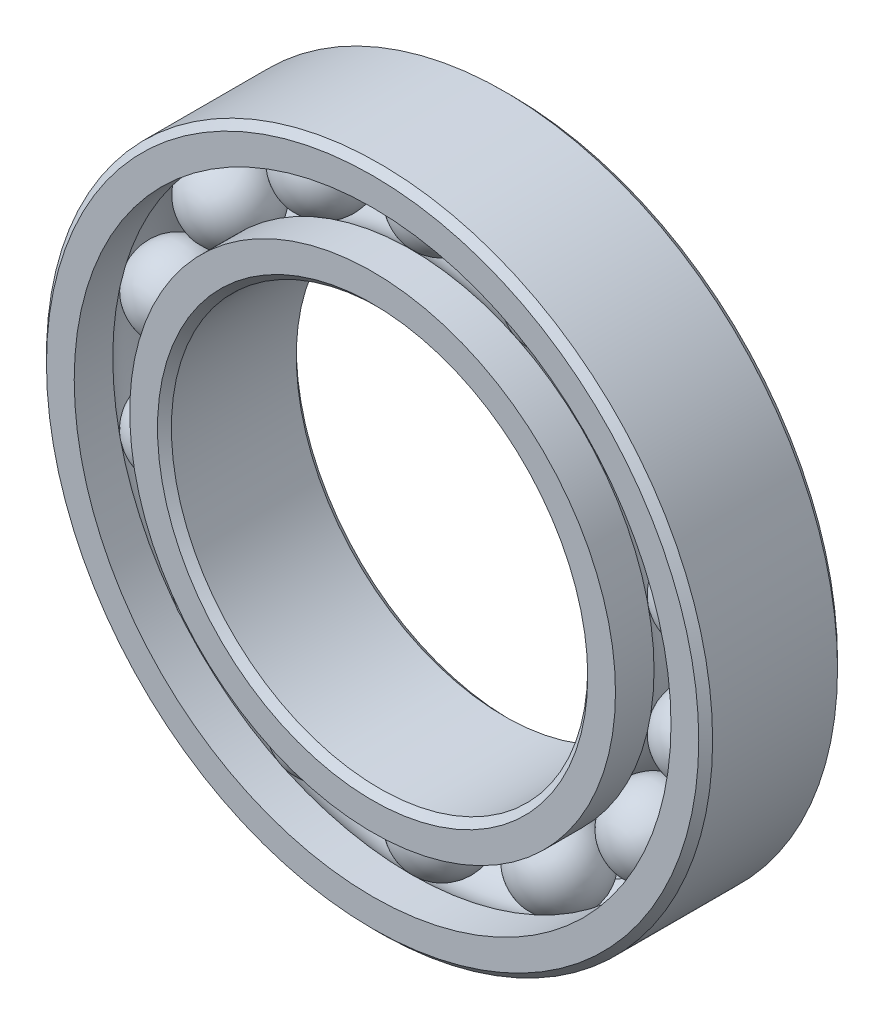
from build123d import *

# Parameters (mm, degrees)
CIRPATTERN1_COUNT = 14


with BuildPart() as part:
    # Sketch5 → Revolve1 (revolve)
    with BuildSketch(Plane(origin=(0, 0, 0), x_dir=(0, 0, -1), z_dir=(1, 0, 0))):
        with BuildLine():
            Line((2.25, 12), (-2.25, 12))
            Line((-2.25, 12), (-2.5, 11.75))
            Line((-2.5, 11.75), (-2.5, 10.75))
            Line((-2.5, 10.75), (-1.111111111, 10.75))
            ThreePointArc((-1.111111111, 10.75), (0, 11.244847116), (1.111111111, 10.75))
            Line((1.111111111, 10.75), (2.5, 10.75))
            Line((2.5, 10.75), (2.5, 11.75))
            Line((2.5, 11.75), (2.25, 12))
        make_face()
    revolve(axis=Axis((0, 0, 2.5), (0, 0, -1)))


with BuildPart() as body_2:
    # Sketch3 → Revolve3 (revolve)
    with BuildSketch(Plane(origin=(0, 0, 0), x_dir=(0, 0, -1), z_dir=(1, 0, 0))):
        with BuildLine():
            Line((-2.5, 8.75), (-1.111111111, 8.75))
            ThreePointArc((-1.111111111, 8.75), (0, 8.255152884), (1.111111111, 8.75))
            Line((1.111111111, 8.75), (2.5, 8.75))
            Line((2.5, 8.75), (2.5, 7.75))
            Line((2.5, 7.75), (2.25, 7.5))
            Line((2.25, 7.5), (-2.25, 7.5))
            Line((-2.25, 7.5), (-2.5, 7.75))
            Line((-2.5, 7.75), (-2.5, 8.75))
        make_face()
    revolve(axis=Axis((0, 0, 2.5), (0, 0, -1)))


with BuildPart() as body_3:
    # Sketch4 → Revolve4 (revolve)
    with BuildSketch(Plane(origin=(0, 0, 0), x_dir=(0, 0, -1), z_dir=(1, 0, 0))):
        with BuildLine():
            Line((-1.494847116, 9.75), (1.494847116, 9.75))
            ThreePointArc((1.494847116, 9.75), (0, 11.244847116), (-1.494847116, 9.75))
        make_face()
    revolve(axis=Axis((0, 9.75, 1.494847116), (0, 0, -1)))


with BuildPart() as cirpattern1_1:
    # CirPattern1: pattern copy
    add(body_3.part.rotate(Axis((0, 0, 0), (0, 0, 1)), 1 * 360 / CIRPATTERN1_COUNT))


with BuildPart() as cirpattern1_2:
    # CirPattern1: pattern copy
    add(body_3.part.rotate(Axis((0, 0, 0), (0, 0, 1)), 2 * 360 / CIRPATTERN1_COUNT))


with BuildPart() as cirpattern1_3:
    # CirPattern1: pattern copy
    add(body_3.part.rotate(Axis((0, 0, 0), (0, 0, 1)), 3 * 360 / CIRPATTERN1_COUNT))


with BuildPart() as cirpattern1_4:
    # CirPattern1: pattern copy
    add(body_3.part.rotate(Axis((0, 0, 0), (0, 0, 1)), 4 * 360 / CIRPATTERN1_COUNT))


with BuildPart() as cirpattern1_5:
    # CirPattern1: pattern copy
    add(body_3.part.rotate(Axis((0, 0, 0), (0, 0, 1)), 5 * 360 / CIRPATTERN1_COUNT))


with BuildPart() as cirpattern1_6:
    # CirPattern1: pattern copy
    add(body_3.part.rotate(Axis((0, 0, 0), (0, 0, 1)), 6 * 360 / CIRPATTERN1_COUNT))


with BuildPart() as cirpattern1_7:
    # CirPattern1: pattern copy
    add(body_3.part.rotate(Axis((0, 0, 0), (0, 0, 1)), 7 * 360 / CIRPATTERN1_COUNT))


with BuildPart() as cirpattern1_8:
    # CirPattern1: pattern copy
    add(body_3.part.rotate(Axis((0, 0, 0), (0, 0, 1)), 8 * 360 / CIRPATTERN1_COUNT))


with BuildPart() as cirpattern1_9:
    # CirPattern1: pattern copy
    add(body_3.part.rotate(Axis((0, 0, 0), (0, 0, 1)), 9 * 360 / CIRPATTERN1_COUNT))


with BuildPart() as cirpattern1_10:
    # CirPattern1: pattern copy
    add(body_3.part.rotate(Axis((0, 0, 0), (0, 0, 1)), 10 * 360 / CIRPATTERN1_COUNT))


with BuildPart() as cirpattern1_11:
    # CirPattern1: pattern copy
    add(body_3.part.rotate(Axis((0, 0, 0), (0, 0, 1)), 11 * 360 / CIRPATTERN1_COUNT))


with BuildPart() as cirpattern1_12:
    # CirPattern1: pattern copy
    add(body_3.part.rotate(Axis((0, 0, 0), (0, 0, 1)), 12 * 360 / CIRPATTERN1_COUNT))


with BuildPart() as cirpattern1_13:
    # CirPattern1: pattern copy
    add(body_3.part.rotate(Axis((0, 0, 0), (0, 0, 1)), 13 * 360 / CIRPATTERN1_COUNT))


solid = Compound([part.part, body_2.part, body_3.part, cirpattern1_1.part, cirpattern1_2.part, cirpattern1_3.part, cirpattern1_4.part, cirpattern1_5.part, cirpattern1_6.part, cirpattern1_7.part, cirpattern1_8.part, cirpattern1_9.part, cirpattern1_10.part, cirpattern1_11.part, cirpattern1_12.part, cirpattern1_13.part])
